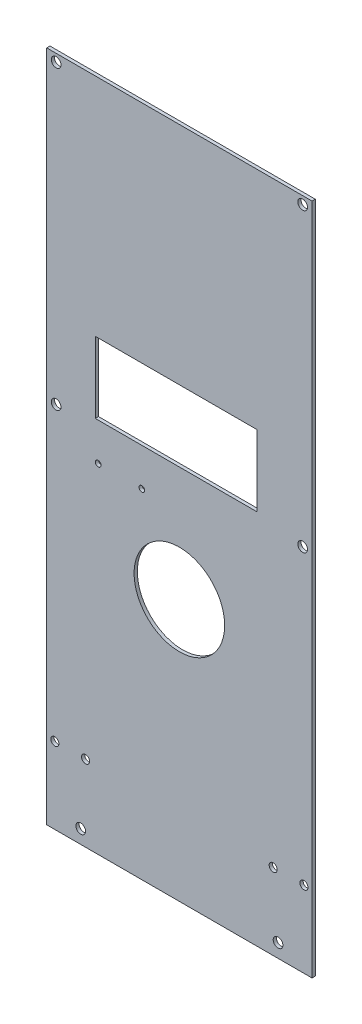
from build123d import *

# Parameters (mm, degrees)
SKETCH1_W                    = 82
SKETCH1_H                    = 208
BOSS_EXTRUDE1_DEPTH          = 1
F_3_0_3_DIAMETER_HOLE1_D     = 3
SKETCH8_R                    = 14
CUT_EXTRUDE1_DEPTH           = 10
SKETCH11_W                   = 50
SKETCH11_H                   = 22
CUT_EXTRUDE2_DEPTH           = 10
F_2_5_2_5_DIAMETER_HOLE1_D   = 2.5
F_1_75_1_75_DIAMETER_HOLE1_D = 1.75


with BuildPart() as part:
    # Sketch1 → Boss-Extrude1 (new body)
    with BuildSketch(Plane.XY):
        Rectangle(SKETCH1_W, SKETCH1_H)
    extrude(amount=BOSS_EXTRUDE1_DEPTH)

    # Ø3.0 (3) Diameter Hole1 (through all)
    with Locations(Plane.XY.offset(1)):
        with Locations((-38.1, 10), (38.1, 10), (30.5, -99.75), (-30.5, -99.75), (-38.1, 101.59999968), (38.1, 101.59999968)):
            Hole(F_3_0_3_DIAMETER_HOLE1_D / 2)

    # Sketch8 → Cut-Extrude1 (cut)
    with BuildSketch(Plane.XY.offset(1)):
        with Locations((0, -23.15)):
            Circle(SKETCH8_R)
    extrude(amount=-CUT_EXTRUDE1_DEPTH, mode=Mode.SUBTRACT)

    # Sketch11 → Cut-Extrude2 (cut)
    with BuildSketch(Plane.XY.offset(1)):
        with Locations((-1, 23.3)):
            Rectangle(SKETCH11_W, SKETCH11_H)
    extrude(amount=-CUT_EXTRUDE2_DEPTH, mode=Mode.SUBTRACT)

    # Ø2.5 (2.5) Diameter Hole1 (through all)
    with Locations(Plane.XY.offset(1)):
        with Locations((-38.5, -80.402796493), (-29, -80.402796493), (29, -80.402796493), (38.5, -80.402796493)):
            Hole(F_2_5_2_5_DIAMETER_HOLE1_D / 2)

    # Ø1.75 (1.75) Diameter Hole1 (through all)
    with Locations(Plane.XY.offset(1)):
        with Locations((-25.1, 0.65), (-11.6, 0.65)):
            Hole(F_1_75_1_75_DIAMETER_HOLE1_D / 2)


solid = part.part
